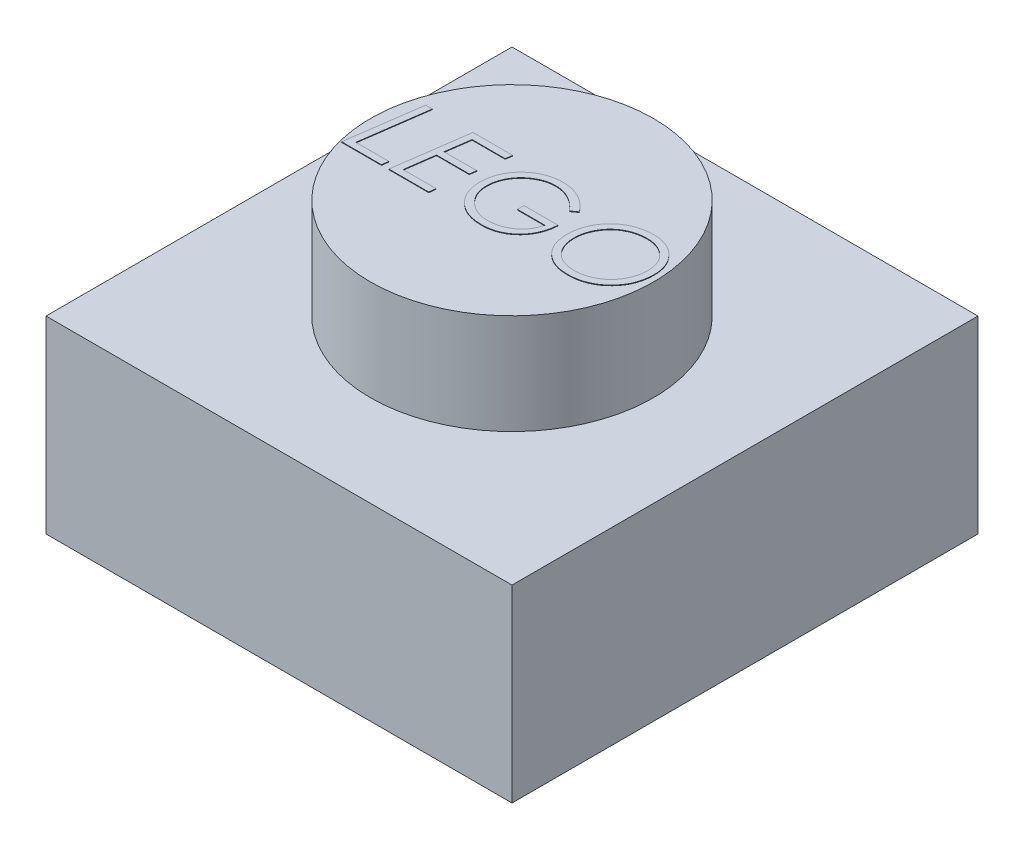
from build123d import *

# Parameters (mm, degrees)
SKETCH1_W           = 7.9
SKETCH1_H           = 7.9
BOSS_EXTRUDE1_DEPTH = 3.2
SKETCH2_R           = 2.4
BOSS_EXTRUDE2_DEPTH = 1.7
BOSS_EXTRUDE4_DEPTH = 0.01
SKETCH4_W           = 6.679581062
SKETCH4_H           = 6.679581062
CUT_EXTRUDE1_DEPTH  = 2.01
BOSS_EXTRUDE5_START = -2.01
BOSS_EXTRUDE5_DEPTH = 2.01


with BuildPart() as part:
    # Sketch1 → Boss-Extrude1 (new body)
    with BuildSketch(Plane(origin=(0, 0, 0), x_dir=(1, 0, 0), z_dir=(0, 1, 0))):
        with Locations((3.95, 3.95)):
            Rectangle(SKETCH1_W, SKETCH1_H)
    extrude(amount=BOSS_EXTRUDE1_DEPTH)

    # Sketch2 → Boss-Extrude2 (add)
    with BuildSketch(Plane(origin=(0, 3.2, 0), x_dir=(1, 0, 0), z_dir=(0, 1, 0))):
        with Locations(Location((3.95, 3.95, 0), (0, 0, 270))):
            Circle(SKETCH2_R)
    extrude(amount=BOSS_EXTRUDE2_DEPTH)

    # Sketch3 → Boss-Extrude4 (add)
    # profile 1 of 4: a face of its own
    with BuildSketch(Plane(origin=(0, 4.9, 0), x_dir=(1, 0, 0), z_dir=(0, 1, 0))):
        Polygon((1.832282536, 4.604898123), (1.945463626, 4.604898123), (1.785708017, 3.46707761), (2.346104652, 3.46707761), (2.331831815, 3.354898123), (1.657002088, 3.354898123), align=None)
    # profile 2 of 4: a face of its own
    with BuildSketch(Plane(origin=(0, 4.9, 0), x_dir=(1, 0, 0), z_dir=(0, 1, 0))):
        Polygon((3.307643113, 4.604898123), (3.289864668, 4.492718636), (2.730720036, 4.492718636), (2.672376687, 4.076051969), (3.227514908, 4.076051969), (3.211489267, 3.963872482), (2.656351046, 3.963872482), (2.586990069, 3.46707761), (3.147386703, 3.46707761), (3.132863466, 3.354898123), (2.458284139, 3.354898123), (2.633564588, 4.604898123), align=None)
    # profile 3 of 4: a face of its own
    with BuildSketch(Plane(origin=(0, 4.9, 0), x_dir=(1, 0, 0), z_dir=(0, 1, 0))):
        with BuildLine():
            Line((4.701873883, 4.341727049), (4.602214428, 4.268359661))
            add(Edge.make_bspline(
                [(4.602214428, 4.268359661), (4.594223081, 4.278463296), (4.578382454, 4.298490949), (4.552974208, 4.326751799), (4.526781942, 4.353389692), (4.49925824, 4.377917229), (4.471083571, 4.40112998), (4.441525281, 4.42204341), (4.410978563, 4.441207159), (4.379659496, 4.458649755), (4.347610579, 4.474125482), (4.315396207, 4.487732834), (4.282869127, 4.498922357), (4.250283005, 4.50864136), (4.217299487, 4.51587276), (4.18414763, 4.520710487), (4.150903008, 4.524293062), (4.128633082, 4.524610402), (4.117438786, 4.524769918)],
                knots=[0, 0, 0, 0, 1.088205139, 2.157064813, 3.209299296, 4.24303109, 5.270682624, 6.292193363, 7.299904734, 8.316436989, 9.319473328, 10.305733085, 11.269264382, 12.22444877, 13.177574148, 14.119122834, 15.054550362, 16, 16, 16, 16], degree=3))
            add(Edge.make_bspline(
                [(4.117438786, 4.524769918), (4.104994375, 4.524521107), (4.080132736, 4.524024028), (4.043033101, 4.520256885), (4.006376299, 4.51354748), (3.969908323, 4.504926578), (3.933893833, 4.493301772), (3.898252767, 4.479273564), (3.86309309, 4.462612711), (3.828430169, 4.443710217), (3.794953431, 4.422557236), (3.762954424, 4.399818018), (3.733183783, 4.375017311), (3.704650221, 4.34913067), (3.678490591, 4.320990985), (3.654040353, 4.291325456), (3.631570613, 4.259970376), (3.610753816, 4.22729124), (3.592321888, 4.193377608), (3.576332398, 4.158696131), (3.562301633, 4.123622124), (3.551463822, 4.087613068), (3.542488613, 4.051135011), (3.536702509, 4.013925289), (3.532682003, 3.976230124), (3.532229884, 3.950862463), (3.532002088, 3.938081216)],
                knots=[0, 0, 0, 0, 0.97704485, 1.95195533, 2.923843304, 3.901415526, 4.89212417, 5.89249681, 6.906854198, 7.94508701, 8.99059592, 10.014519948, 11.024825533, 12.031297736, 13.037428488, 14.038509295, 15.047964276, 16.064309815, 17.079005887, 18.075937854, 19.061713623, 20.042247028, 21.026191147, 22.008802999, 22.996754876, 24, 24, 24, 24], degree=3))
            add(Edge.make_bspline(
                [(3.532002088, 3.938081216), (3.532369323, 3.920940483), (3.533092921, 3.887166428), (3.54080397, 3.83756171), (3.552297071, 3.789703796), (3.569345009, 3.743984102), (3.590663785, 3.700113704), (3.616898701, 3.658340736), (3.647995923, 3.618632516), (3.683169388, 3.581124089), (3.721975609, 3.547190184), (3.762989457, 3.517071082), (3.806208637, 3.491553815), (3.851780792, 3.471217023), (3.899058754, 3.454481236), (3.948703848, 3.443615036), (4.000192874, 3.436168993), (4.035279814, 3.435410998), (4.053085822, 3.435026328)],
                knots=[0, 0, 0, 0, 1.019699772, 2.00921373, 2.981850619, 3.945611549, 4.907936516, 5.881372837, 6.876399243, 7.906447893, 8.938173367, 9.941073143, 10.932270214, 11.919723139, 12.908225854, 13.912405215, 14.940582182, 16, 16, 16, 16], degree=3))
            add(Edge.make_bspline(
                [(4.053085822, 3.435026328), (4.074581254, 3.435599426), (4.11748625, 3.436743331), (4.180872469, 3.447608002), (4.243162184, 3.464003995), (4.303115661, 3.48756372), (4.359892332, 3.516274774), (4.411741714, 3.54979345), (4.457784869, 3.587961635), (4.498384943, 3.630580026), (4.53303885, 3.678554542), (4.563120551, 3.731230233), (4.587740602, 3.789373269), (4.599634966, 3.830601123), (4.605720036, 3.851692995)],
                knots=[0, 0, 0, 0, 1.033792167, 2.063454529, 3.086685911, 4.12966393, 5.157365104, 6.144632769, 7.094686579, 8.02963692, 8.969786061, 9.935985671, 10.944065236, 12, 12, 12, 12], degree=3))
            Line((4.605720036, 3.851692995), (4.140976447, 3.851692995))
            Line((4.140976447, 3.851692995), (4.140976447, 3.963872482))
            Line((4.140976447, 3.963872482), (4.717899524, 3.963872482))
            add(Edge.make_bspline(
                [(4.717899524, 3.963872482), (4.715864452, 3.940537279), (4.711874195, 3.894782885), (4.69942647, 3.828086612), (4.68199329, 3.764774229), (4.659173945, 3.704861641), (4.630919519, 3.648505742), (4.59774963, 3.595348644), (4.559285746, 3.545571633), (4.515814341, 3.499721655), (4.46844757, 3.458302738), (4.417878433, 3.421925394), (4.364351012, 3.391393009), (4.308182236, 3.366007973), (4.248908241, 3.346854494), (4.187007442, 3.33278705), (4.12217798, 3.324364805), (4.078067373, 3.323359246), (4.055589828, 3.322846841)],
                knots=[0, 0, 0, 0, 1.098006248, 2.152910829, 3.176693714, 4.174102283, 5.154427425, 6.128677043, 7.108165613, 8.099464247, 9.087077226, 10.054952015, 11.015803916, 11.972468591, 12.940477937, 13.931877037, 14.946141749, 16, 16, 16, 16], degree=3))
            add(Edge.make_bspline(
                [(4.055589828, 3.322846841), (4.032525547, 3.323342362), (3.987411429, 3.324311611), (3.9214857, 3.332876212), (3.858807865, 3.34620412), (3.799404334, 3.365318809), (3.743277296, 3.389857102), (3.690679177, 3.420179827), (3.641268759, 3.455657405), (3.595689928, 3.496348401), (3.554559756, 3.541197331), (3.518567584, 3.589307242), (3.487743642, 3.639999747), (3.462901044, 3.693721351), (3.443468533, 3.750181555), (3.429856098, 3.809437188), (3.421311108, 3.871476007), (3.420325278, 3.913764014), (3.419822601, 3.935326809)],
                knots=[0, 0, 0, 0, 1.117903688, 2.186638197, 3.21780727, 4.221242465, 5.20706516, 6.182431358, 7.159609539, 8.151436913, 9.139682433, 10.10533578, 11.060397566, 12.011007066, 12.969638005, 13.950363306, 14.954883424, 16, 16, 16, 16], degree=3))
            add(Edge.make_bspline(
                [(3.419822601, 3.935326809), (3.420138952, 3.950859376), (3.420767729, 3.981731803), (3.424963713, 4.027616327), (3.432679126, 4.072646659), (3.442852825, 4.116910735), (3.455965552, 4.160496846), (3.471933961, 4.20328178), (3.491087489, 4.245242481), (3.513047729, 4.286115161), (3.537530339, 4.325600602), (3.564271155, 4.363247138), (3.593498243, 4.398542313), (3.624507556, 4.432098501), (3.658146201, 4.463054417), (3.693847346, 4.491888255), (3.731480716, 4.518905381), (3.77142415, 4.543221398), (3.812846375, 4.565137356), (3.855118915, 4.584605211), (3.898469674, 4.600573637), (3.942428974, 4.613905323), (3.987291028, 4.624144078), (4.032916476, 4.631801844), (4.079465257, 4.63599767), (4.110753822, 4.636631416), (4.12645321, 4.636949405)],
                knots=[0, 0, 0, 0, 1.01034602, 2.008157081, 2.993527994, 3.979930372, 4.960683832, 5.951959865, 6.948100503, 7.958563211, 8.967975239, 9.968308804, 10.959584837, 11.946808627, 12.938010319, 13.930059161, 14.930392727, 15.949048275, 16.969091794, 17.977364349, 18.973726886, 19.971641333, 20.963333569, 21.964771492, 22.978801278, 24, 24, 24, 24], degree=3))
            add(Edge.make_bspline(
                [(4.12645321, 4.636949405), (4.140647989, 4.63666956), (4.168739982, 4.636115737), (4.210476499, 4.63288549), (4.251380819, 4.627152534), (4.29129634, 4.618801418), (4.330484053, 4.608567941), (4.368675988, 4.59577053), (4.406070924, 4.580754735), (4.442474857, 4.563343269), (4.478143584, 4.543914061), (4.512619765, 4.521658579), (4.546625807, 4.497640881), (4.579591338, 4.471153536), (4.611552577, 4.442077414), (4.642675265, 4.410871755), (4.673242279, 4.377555225), (4.692243855, 4.353777591), (4.701873883, 4.341727049)],
                knots=[0, 0, 0, 0, 1.015105213, 2.008930748, 2.991454354, 3.966534974, 4.923490216, 5.886087319, 6.844809209, 7.803252371, 8.770243484, 9.747130909, 10.735853235, 11.746297741, 12.768902994, 13.824016992, 14.897208497, 16, 16, 16, 16], degree=3))
        make_face()
    # profile 4 of 4: a face of its own
    with BuildSketch(Plane(origin=(0, 4.9, 0), x_dir=(1, 0, 0), z_dir=(0, 1, 0))):
        with BuildLine():
            add(Edge.make_bspline(
                [(5.671925966, 4.636949405), (5.692400623, 4.63650345), (5.732667893, 4.635626396), (5.791703582, 4.627669814), (5.84816478, 4.614697282), (5.901922783, 4.596339067), (5.953136821, 4.572927607), (6.001690741, 4.544284414), (6.047399306, 4.510158163), (6.09025375, 4.471611385), (6.129154607, 4.429051867), (6.163160058, 4.383201547), (6.192058383, 4.334734533), (6.215910086, 4.283554512), (6.233823478, 4.229366588), (6.246743033, 4.172603876), (6.255145963, 4.113110877), (6.255950492, 4.072491917), (6.256361062, 4.051763107)],
                knots=[0, 0, 0, 0, 1.061681398, 2.087996504, 3.083659545, 4.062660971, 5.02945529, 5.999994507, 6.981138296, 7.983640916, 8.985844288, 9.966988076, 10.939736476, 11.908342154, 12.890058995, 13.894159216, 14.925339913, 16, 16, 16, 16], degree=3))
            add(Edge.make_bspline(
                [(6.256361062, 4.051763107), (6.25623821, 4.038988627), (6.255995471, 4.01374805), (6.253408976, 3.976225127), (6.249128591, 3.939561124), (6.243455349, 3.903597875), (6.235835613, 3.868539787), (6.226924527, 3.834140064), (6.216051359, 3.800598383), (6.20384118, 3.767696929), (6.189792262, 3.735595516), (6.173946521, 3.704324105), (6.15669213, 3.673663515), (6.137607818, 3.643838863), (6.11686312, 3.614849105), (6.094393683, 3.586665409), (6.070489857, 3.559187301), (6.044887258, 3.532733386), (6.018336956, 3.507212599), (5.990529993, 3.48355884), (5.962091012, 3.461350566), (5.932834084, 3.440746086), (5.90250067, 3.422121085), (5.871581935, 3.404690573), (5.839905885, 3.388861691), (5.807185809, 3.375183309), (5.773789823, 3.362832151), (5.739620564, 3.352089492), (5.704582969, 3.343076229), (5.668762424, 3.335500733), (5.632062087, 3.329787275), (5.594535036, 3.325855801), (5.556279304, 3.323200874), (5.530454147, 3.322965537), (5.51742877, 3.322846841)],
                knots=[0, 0, 0, 0, 1.057694632, 2.089855924, 3.112648636, 4.113725536, 5.103331559, 6.082381806, 7.055068159, 8.021768845, 8.98743121, 9.954922249, 10.923671581, 11.89959402, 12.885451751, 13.874212627, 14.883322035, 15.900071676, 16.921812937, 17.931632203, 18.921551953, 19.909055848, 20.892997665, 21.867769094, 22.84762411, 23.823252803, 24.802912784, 25.795362855, 26.787788858, 27.797679081, 28.826061376, 29.861826465, 30.921574152, 32, 32, 32, 32], degree=3))
            add(Edge.make_bspline(
                [(5.51742877, 3.322846841), (5.495540081, 3.323312388), (5.45279647, 3.324221496), (5.390401025, 3.331753811), (5.331466149, 3.34468508), (5.275615882, 3.361975519), (5.223270197, 3.38492417), (5.174339628, 3.412892082), (5.128783581, 3.445910526), (5.086763869, 3.483632016), (5.049135515, 3.525626819), (5.016044394, 3.570822838), (4.988418107, 3.619388761), (4.96538613, 3.670881503), (4.948106883, 3.725740589), (4.935156589, 3.783416472), (4.927613141, 3.844314319), (4.926699871, 3.88597706), (4.926232857, 3.907281937)],
                knots=[0, 0, 0, 0, 1.121422378, 2.189881799, 3.214223923, 4.209829567, 5.180887389, 6.136870002, 7.092517675, 8.058664933, 9.02481219, 9.976998316, 10.923432162, 11.882748215, 12.86205079, 13.865508147, 14.908495107, 16, 16, 16, 16], degree=3))
            add(Edge.make_bspline(
                [(4.926232857, 3.907281937), (4.92651465, 3.92390256), (4.927073619, 3.956871533), (4.931757127, 4.005792823), (4.939128338, 4.053761359), (4.950024433, 4.100549976), (4.963594459, 4.14639076), (4.979990494, 4.191253803), (5.000003008, 4.234848241), (5.022452359, 4.277389438), (5.047513645, 4.318359564), (5.07559856, 4.356880644), (5.105216605, 4.393691441), (5.137816677, 4.42780852), (5.172496353, 4.459796588), (5.209524734, 4.489546335), (5.248906172, 4.516814917), (5.290422211, 4.541753927), (5.333531205, 4.564369022), (5.378335052, 4.583562961), (5.424193072, 4.600182058), (5.471345954, 4.613795807), (5.519847317, 4.623918047), (5.569406413, 4.631466127), (5.620254649, 4.636113027), (5.6545551, 4.636668231), (5.671925966, 4.636949405)],
                knots=[0, 0, 0, 0, 1.027038055, 2.037251559, 3.03463374, 4.024476576, 5.003805404, 5.987972729, 6.973761106, 7.966047439, 8.95963362, 9.938921687, 10.910571097, 11.877553313, 12.852319973, 13.824735949, 14.81069978, 15.81041387, 16.816403723, 17.816876174, 18.82042938, 19.829469955, 20.847307225, 21.880377804, 22.926554263, 24, 24, 24, 24], degree=3))
        make_face()
        with BuildLine():
            add(Edge.make_bspline(
                [(5.671925966, 4.524769918), (5.65697579, 4.524545747), (5.627444828, 4.524102944), (5.583747158, 4.520086709), (5.541191397, 4.514393729), (5.499970629, 4.505322476), (5.459846772, 4.494612055), (5.421182876, 4.480527241), (5.383524652, 4.464643931), (5.34726264, 4.446055377), (5.312516644, 4.425361321), (5.279529586, 4.402463835), (5.248469657, 4.377453479), (5.219370347, 4.350164922), (5.191739723, 4.321307483), (5.166361885, 4.289965789), (5.142845474, 4.256628787), (5.121196386, 4.221501346), (5.10164712, 4.185107003), (5.08492909, 4.147719282), (5.070612165, 4.109847114), (5.058744989, 4.071497155), (5.049737471, 4.032481304), (5.043287884, 3.99291855), (5.039049877, 3.95269661), (5.03862585, 3.92565532), (5.038412344, 3.912039549)],
                knots=[0, 0, 0, 0, 1.093710758, 2.16039807, 3.20900896, 4.233234191, 5.246749975, 6.245527847, 7.241594159, 8.235879922, 9.224691631, 10.198908654, 11.171861231, 12.139893662, 13.116290872, 14.093089164, 15.087825051, 16.099756899, 17.110766713, 18.108591704, 19.094380672, 20.071961556, 21.043859171, 22.021859724, 23.00397114, 24, 24, 24, 24], degree=3))
            add(Edge.make_bspline(
                [(5.038412344, 3.912039549), (5.038625982, 3.900599914), (5.039049193, 3.877938292), (5.041777549, 3.844392517), (5.046595514, 3.811801965), (5.053065301, 3.780081073), (5.061542906, 3.749273697), (5.072183234, 3.719394567), (5.084405544, 3.690349568), (5.098393626, 3.662290632), (5.114175341, 3.635553687), (5.131389377, 3.61020951), (5.150226394, 3.586682218), (5.170360361, 3.564729612), (5.191972025, 3.544421151), (5.214980987, 3.52555365), (5.239648771, 3.508615875), (5.265465573, 3.492943288), (5.292687864, 3.479247808), (5.321165948, 3.467438697), (5.350786278, 3.457432665), (5.381544214, 3.449135171), (5.413524888, 3.442928532), (5.44663118, 3.438448028), (5.480905707, 3.435639812), (5.504152208, 3.435232585), (5.515926367, 3.435026328)],
                knots=[0, 0, 0, 0, 1.083699529, 2.146780792, 3.185591126, 4.202843058, 5.211856999, 6.209655863, 7.20532214, 8.195415879, 9.177202942, 10.14436246, 11.095191523, 12.029705806, 12.963818608, 13.902338257, 14.845476191, 15.796042213, 16.761390084, 17.729066592, 18.714222808, 19.721158958, 20.74459932, 21.797962164, 22.884686177, 24, 24, 24, 24], degree=3))
            add(Edge.make_bspline(
                [(5.515926367, 3.435026328), (5.530044188, 3.435228857), (5.558004277, 3.435629962), (5.599524853, 3.440000997), (5.64032433, 3.445959686), (5.680325762, 3.455225454), (5.71965402, 3.466535035), (5.757982705, 3.481070895), (5.795756024, 3.497476377), (5.83237428, 3.51683082), (5.867802238, 3.538111172), (5.901266528, 3.561837848), (5.932774032, 3.587459191), (5.962816859, 3.614626895), (5.990234918, 3.644356353), (6.016009711, 3.675809964), (6.039684501, 3.709331455), (6.061465654, 3.744601276), (6.080935982, 3.781209824), (6.097718361, 3.818903041), (6.112024773, 3.857287248), (6.123844079, 3.896320217), (6.132886835, 3.936161865), (6.139301688, 3.976648339), (6.14355343, 4.017951988), (6.143970816, 4.04574289), (6.144181575, 4.059775927)],
                knots=[0, 0, 0, 0, 1.029812959, 2.039525905, 3.043952503, 4.036919093, 5.033391511, 6.027870106, 7.026035071, 8.036794627, 9.047957848, 10.039952554, 11.027355318, 12.010276797, 12.992858524, 13.975534638, 14.976019862, 15.985163142, 16.99876328, 17.999396818, 18.993875413, 19.986244033, 20.973271002, 21.972624612, 22.976275263, 24, 24, 24, 24], degree=3))
            add(Edge.make_bspline(
                [(6.144181575, 4.059775927), (6.143688983, 4.077993105), (6.142724583, 4.113658826), (6.13551886, 4.16576722), (6.122807184, 4.214771606), (6.105892747, 4.261149785), (6.083400704, 4.304354629), (6.056090597, 4.344736825), (6.024020374, 4.382453222), (5.999069145, 4.404451295), (5.986429171, 4.415595238)],
                knots=[0, 0, 0, 0, 1.085318323, 2.124844004, 3.126009127, 4.096923137, 5.060061729, 6.020100862, 6.997008382, 8, 8, 8, 8], degree=3))
            add(Edge.make_bspline(
                [(5.986429171, 4.415595238), (5.97539623, 4.42431843), (5.953439426, 4.44167857), (5.917982347, 4.463870828), (5.881057133, 4.482788681), (5.842389242, 4.498145486), (5.802091847, 4.510165945), (5.760106575, 4.518646998), (5.716539836, 4.523741692), (5.686963766, 4.524423338), (5.671925966, 4.524769918)],
                knots=[0, 0, 0, 0, 0.992364662, 1.974918139, 2.947382948, 3.917989177, 4.907989082, 5.912266894, 6.938502841, 8, 8, 8, 8], degree=3))
        make_face(mode=Mode.SUBTRACT)
    extrude(amount=BOSS_EXTRUDE4_DEPTH)

    # Sketch4 → Cut-Extrude1 (cut)
    with BuildSketch(Plane.XZ):
        with Locations((3.960209469, -3.960209469)):
            Rectangle(SKETCH4_W, SKETCH4_H)
    extrude(amount=-CUT_EXTRUDE1_DEPTH, mode=Mode.SUBTRACT)

    # Sketch5 → Boss-Extrude5 (add)
    with BuildSketch(Plane(origin=(0, 3.2, 0), x_dir=(1, 0, 0), z_dir=(0, 1, 0)).offset(BOSS_EXTRUDE5_START)):
        with BuildLine():
            Line((6.369527619, 1.557811677), (5.363437843, 1.557811677))
            ThreePointArc((5.363437843, 1.557811677), (6.369527619, 0.551721901), (7.375617394, 1.557811677))
            ThreePointArc((7.375617394, 1.557811677), (7.080940521, 2.269224579), (6.369527619, 2.563901452))
            Line((6.369527619, 2.563901452), (6.369527619, 1.557811677))
        make_face()
        with BuildLine():
            Line((1.458127833, 2.579758881), (1.458127833, 1.557811677))
            Line((1.458127833, 1.557811677), (2.480075037, 1.557811677))
            ThreePointArc((2.480075037, 1.557811677), (2.180753631, 2.280437475), (1.458127833, 2.579758881))
        make_face()
        with BuildLine():
            Line((2.480075037, 1.557811677), (1.458127833, 1.557811677))
            Line((1.458127833, 1.557811677), (1.458127833, 2.579758881))
            ThreePointArc((1.458127833, 2.579758881), (0.735502035, 0.835185879), (2.480075037, 1.557811677))
        make_face()
        with BuildLine():
            ThreePointArc((5.605437996, 2.21232194), (5.425875301, 1.906719887), (5.363437843, 1.557811677))
            Line((5.363437843, 1.557811677), (6.369527619, 1.557811677))
            Line((6.369527619, 1.557811677), (6.369527619, 2.563901452))
            ThreePointArc((6.369527619, 2.563901452), (6.015263465, 2.499466361), (5.706377057, 2.31441459))
            ThreePointArc((5.706377057, 2.31441459), (5.656671092, 2.262613327), (5.605437996, 2.21232194))
        make_face()
        with BuildLine():
            ThreePointArc((7.385597221, 6.365232327), (6.369527619, 7.381301929), (5.353458016, 6.365232327))
            Line((5.353458016, 6.365232327), (6.369527619, 6.365232327))
            Line((6.369527619, 6.365232327), (6.369527619, 5.349162725))
            ThreePointArc((6.369527619, 5.349162725), (7.087997324, 5.646762621), (7.385597221, 6.365232327))
        make_face()
        with BuildLine():
            Line((6.369527619, 6.365232327), (5.353458016, 6.365232327))
            ThreePointArc((5.353458016, 6.365232327), (5.651057913, 5.646762621), (6.369527619, 5.349162725))
            Line((6.369527619, 5.349162725), (6.369527619, 6.365232327))
        make_face()
        with BuildLine():
            ThreePointArc((2.499242709, 6.365232327), (0.721948444, 7.101411716), (1.458127833, 5.324117451))
            Line((1.458127833, 5.324117451), (1.458127833, 6.365232327))
            Line((1.458127833, 6.365232327), (2.499242709, 6.365232327))
        make_face()
        with BuildLine():
            Line((1.458127833, 6.365232327), (1.458127833, 5.324117451))
            ThreePointArc((1.458127833, 5.324117451), (2.194307222, 5.629052938), (2.499242709, 6.365232327))
            Line((2.499242709, 6.365232327), (1.458127833, 6.365232327))
        make_face()
    extrude(amount=BOSS_EXTRUDE5_DEPTH)


solid = part.part
